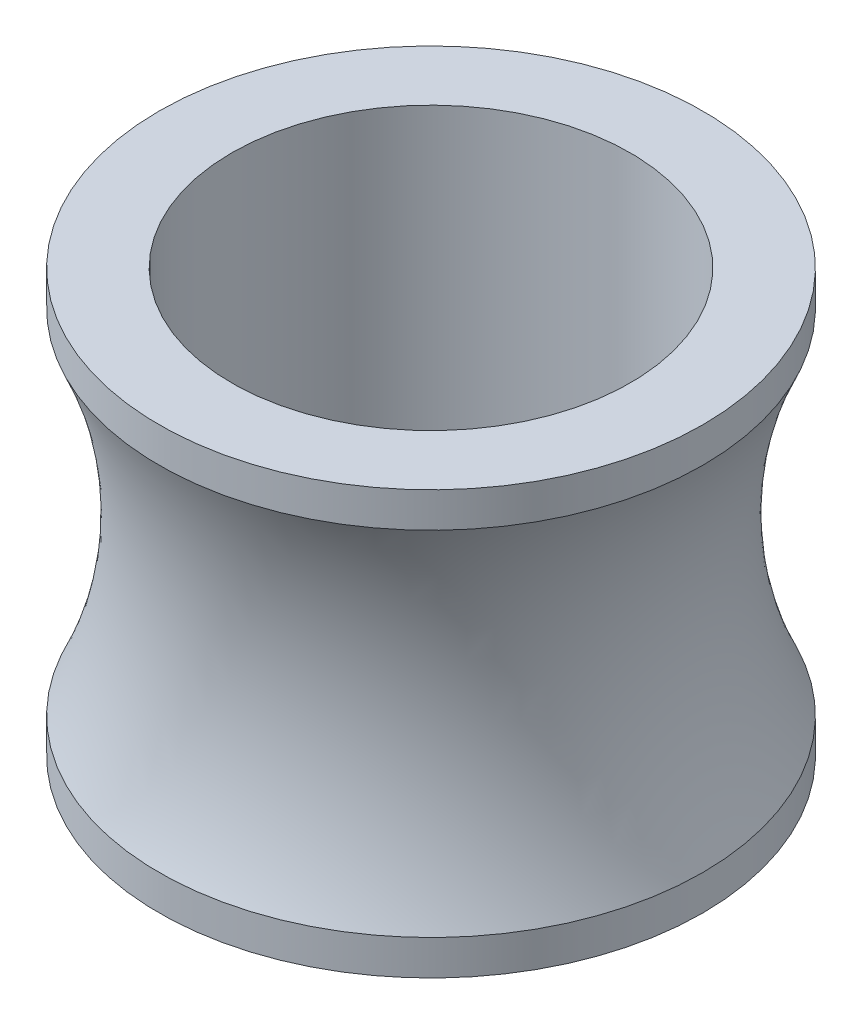
from build123d import *


with BuildPart() as part:
    # 草图1 → 旋转2 (revolve)
    with BuildSketch(Plane.XY, mode=Mode.PRIVATE) as revolve_2_sk:
        with BuildLine():
            Line((33, 35), (45, 35))
            Line((45, 35), (45, 29.193652228))
            ThreePointArc((45, 29.193652228), (38.621778265, 0), (45, -29.193652228))
            Line((45, -29.193652228), (45, -35))
            Line((45, -35), (33, -35))
            Line((33, -35), (33, 35))
        make_face()
    revolve(revolve_2_sk.sketch.rotate(Axis((0, 35, 0), (0, -1, 0)), 180), axis=Axis((0, 35, 0), (0, -1, 0)))


solid = part.part
